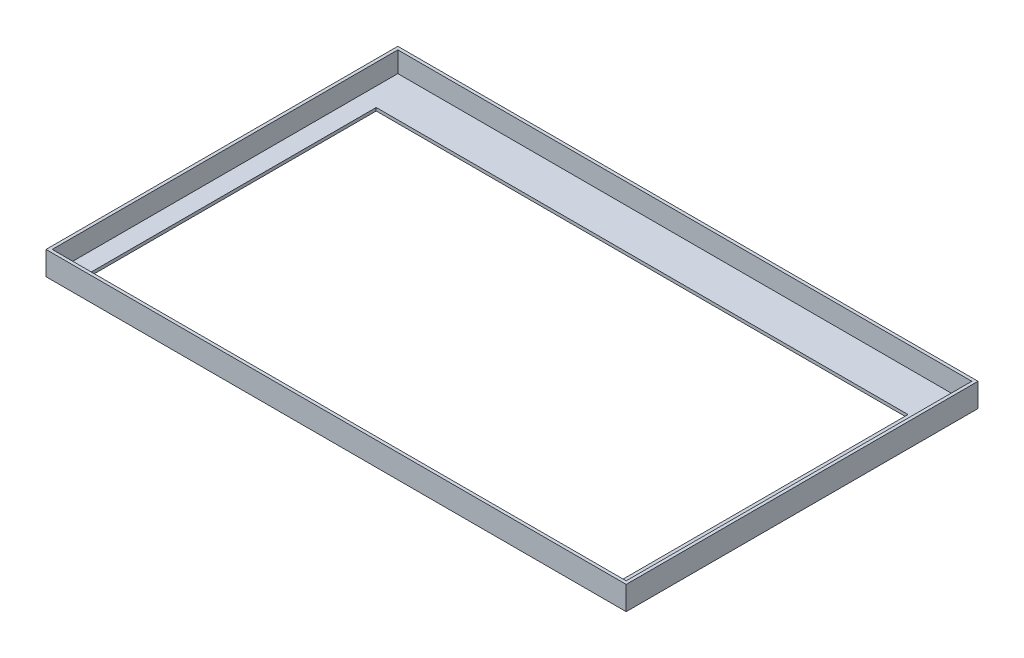
from build123d import *

# Parameters (mm, degrees)
SKETCH1_W           = 282
SKETCH1_H           = 171
BOSS_EXTRUDE1_DEPTH = 1.5
SKETCH2_W           = 282
SKETCH2_H           = 171
SKETCH2_W_2         = 279
SKETCH2_H_2         = 168
BOSS_EXTRUDE2_DEPTH = 10
SKETCH3_W           = 258.5
SKETCH3_H           = 145
CUT_EXTRUDE1_DEPTH  = 10


with BuildPart() as part:
    # Sketch1 → Boss-Extrude1 (new body)
    with BuildSketch(Plane(origin=(0, 0, 0), x_dir=(1, 0, 0), z_dir=(0, 1, 0))):
        with Locations((141, -85.5)):
            Rectangle(SKETCH1_W, SKETCH1_H)
    extrude(amount=BOSS_EXTRUDE1_DEPTH)

    # Sketch2 → Boss-Extrude2 (add)
    with BuildSketch(Plane(origin=(0, 1.5, 0), x_dir=(1, 0, 0), z_dir=(0, 1, 0))):
        with Locations((141, -85.5)):
            Rectangle(SKETCH2_W, SKETCH2_H)
        with Locations((141, -85.5)):
            Rectangle(SKETCH2_W_2, SKETCH2_H_2, mode=Mode.SUBTRACT)
    extrude(amount=BOSS_EXTRUDE2_DEPTH)

    # Sketch3 → Cut-Extrude1 (cut)
    with BuildSketch(Plane(origin=(0, 1.5, 0), x_dir=(1, 0, 0), z_dir=(0, 1, 0))):
        with Locations((139.75, -93.5)):
            Rectangle(SKETCH3_W, SKETCH3_H)
    extrude(amount=-CUT_EXTRUDE1_DEPTH, mode=Mode.SUBTRACT)


solid = part.part
